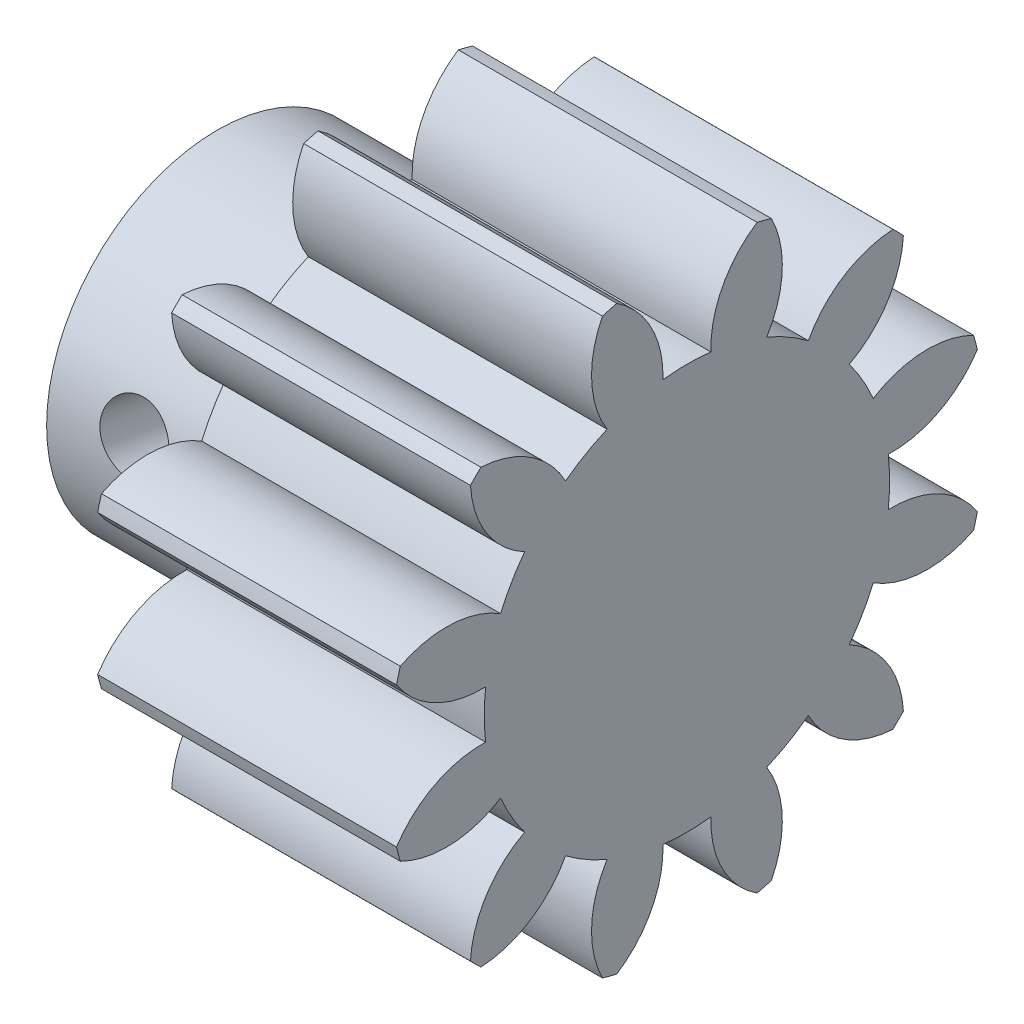
from build123d import *

# Parameters (mm, degrees)
BASPROSKE_W                  = 7
BASPROSKE_H                  = 7
TOOTHCUT_DEPTH               = 13.124355653
TEETHCUTS_COUNT              = 12
TEETHCUTS_ANGLE              = 330
HUBNEAONESKE_R               = 4
HUBNEARONE_DEPTH             = 4
BORSKE_R                     = 2
BORE_DEPTH                   = 12.0000508
ESQUISSE1_R                  = 2
BOSS_EXTRU_1_DEPTH           = 4
R_P_TITION_CIRCULAIRE1_COUNT = 2
R_P_TITION_CIRCULAIRE1_ANGLE = 90


with BuildPart() as part:
    # BasProSke → Base-Revolve (revolve)
    with BuildSketch(Plane(origin=(0, 0, 0), x_dir=(1, 0, 0), z_dir=(0, 1, 0)), mode=Mode.PRIVATE) as base_revolve_sk:
        with Locations((3.5, 3.5)):
            Rectangle(BASPROSKE_W, BASPROSKE_H)
    revolve(base_revolve_sk.sketch.rotate(Axis((-10, 0, 0), (1, 0, 0)), 180), axis=Axis((-10, 0, 0), (1, 0, 0)))

    # TooCutSke → ToothCut (cut, through all)
    with BuildSketch(Plane(origin=(0, 0, 0), x_dir=(0, 0, -1), z_dir=(1, 0, 0))):
        with BuildLine():
            ThreePointArc((0.562207301, 4.715604304), (0, 4.749), (-0.562207301, 4.715604304))
            ThreePointArc((-0.562207301, 4.715604304), (-0.837528627, 5.917009812), (-1.672850686, 6.823328788))
            ThreePointArc((-1.672850686, 6.823328788), (0, 7.0254), (1.672850686, 6.823328788))
            ThreePointArc((1.672850686, 6.823328788), (0.837528627, 5.917009812), (0.562207301, 4.715604304))
        make_face()
    toothcut = extrude(amount=TOOTHCUT_DEPTH, mode=Mode.SUBTRACT)

    # TeethCuts: ToothCut ×12 about axis
    teethcuts_axis = Axis((-10, 0, 0), (1, 0, 0))
    for i in range(1, TEETHCUTS_COUNT):
        add(toothcut.rotate(teethcuts_axis, i * TEETHCUTS_ANGLE / (TEETHCUTS_COUNT - 1)), mode=Mode.SUBTRACT)

    # HubNeaOneSke → HubNearOne (add)
    with BuildSketch(Plane.ZY):
        with Locations(Location((0, 0, 0), (0, 0, 180))):
            Circle(HUBNEAONESKE_R)
    extrude(amount=HUBNEARONE_DEPTH)

    # BorSke → Bore (cut, symmetric)
    with BuildSketch(Plane(origin=(0, 0, 0), x_dir=(0, 0, -1), z_dir=(1, 0, 0))):
        with Locations(Location((0, 0, 0), (0, 0, 180))):
            Circle(BORSKE_R)
    extrude(amount=BORE_DEPTH, both=True, mode=Mode.SUBTRACT)

    # Esquisse1 → Boss.-Extru.1 (add)
    with BuildSketch(Plane(origin=(7, 0, 0), x_dir=(0, 0, -1), z_dir=(1, 0, 0))):
        with Locations(Location((0, 0, 0), (0, 0, 180))):
            Circle(ESQUISSE1_R)
    extrude(amount=-BOSS_EXTRU_1_DEPTH)

    # Esquisse5 → Trou pour taraudage pour trou taraudé M2x0.41 (revolve, cut)
    with BuildSketch(Plane(origin=(-2, -3.943103852, 0.672258885), x_dir=(0, -0.1680647213420592, -0.9857759631073463), z_dir=(1, 0, 0))):
        Polygon((0, 0), (0, 5.480688495), (0.8, 5), (0.8, 0), align=None)
    trou_pour_taraudage_pour_trou_taraud_m2 = revolve(axis=Axis((-2, -10.202781218, 1.739469866), (0, 0.9857759631073462, -0.1680647213420592)), mode=Mode.SUBTRACT)

    # Répétition circulaire1: Trou pour taraudage pour trou taraudé M2x0.41 ×2 about axis
    r_p_tition_circulaire1_axis = Axis((12.0000508, 0, 0), (-1, 0, 0))
    for i in range(1, R_P_TITION_CIRCULAIRE1_COUNT):
        add(trou_pour_taraudage_pour_trou_taraud_m2.rotate(r_p_tition_circulaire1_axis, i * R_P_TITION_CIRCULAIRE1_ANGLE / (R_P_TITION_CIRCULAIRE1_COUNT - 1)), mode=Mode.SUBTRACT)


solid = part.part
